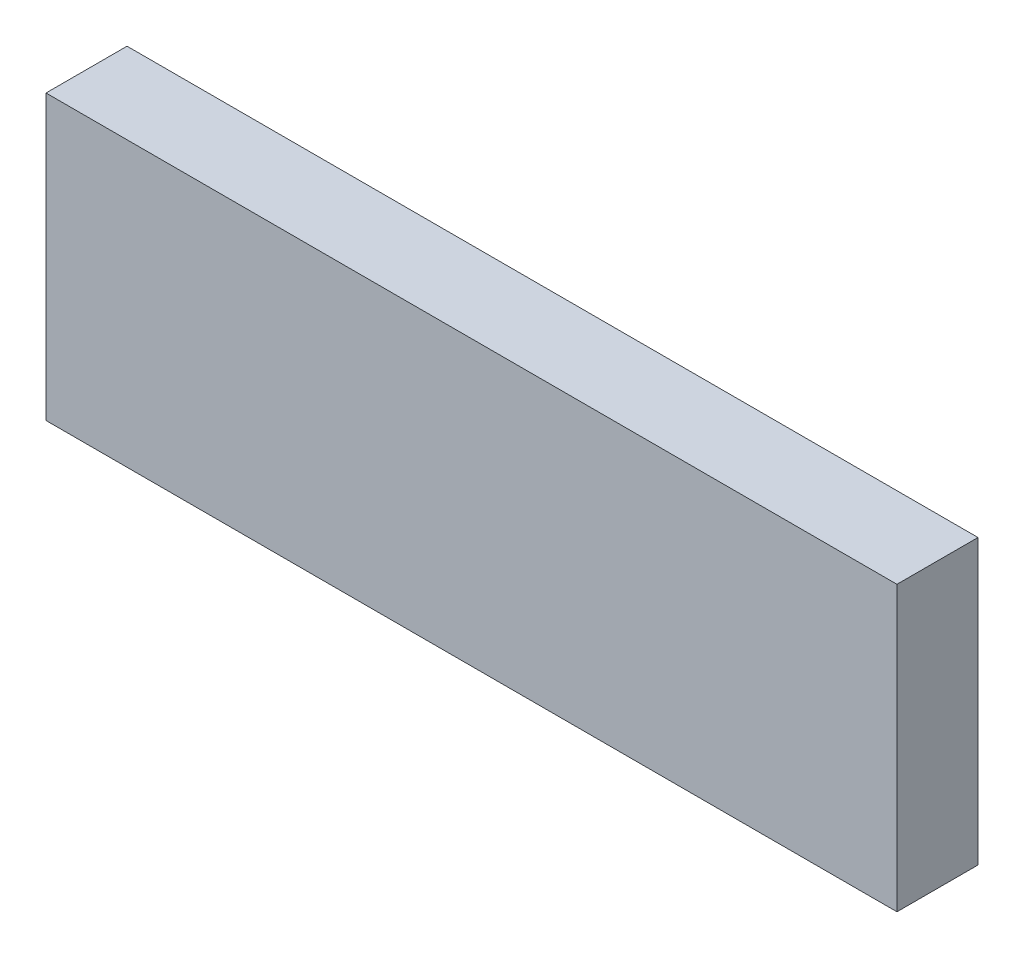
from build123d import *

# Parameters (mm, degrees)
SKETCH_1_W      = 210
SKETCH_1_H      = 70
EXTRUDE_1_DEPTH = 20


with BuildPart() as part:
    # 草图1 → 凸台-拉伸1 (new body)
    with BuildSketch(Plane.XY):
        Rectangle(SKETCH_1_W, SKETCH_1_H)
    extrude(amount=EXTRUDE_1_DEPTH)


solid = part.part
